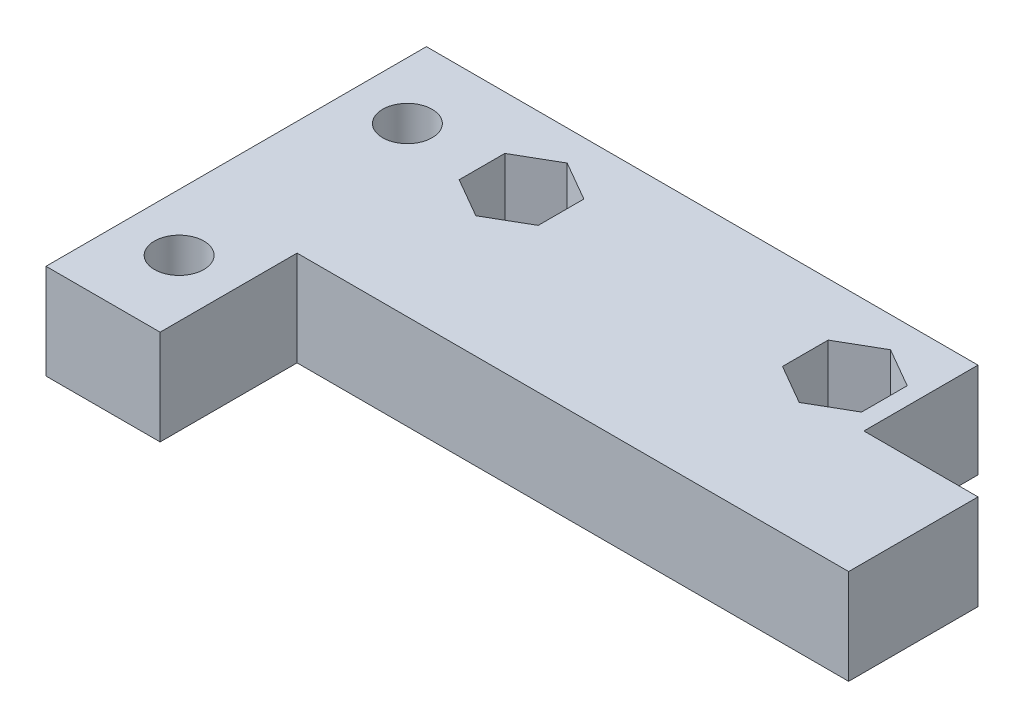
from build123d import *

# Parameters (mm, degrees)
SKETCH_1_W           = 35
SKETCH_1_H           = 20
EXTRUDE_1_DEPTH      = 8
SKETCH_2_W           = 29
SKETCH_2_H           = 14
CUT_EXTRUDE_2_DEPTH  = 0.8
SKETCH_3_W           = 29
SKETCH_3_H           = 7.2
CUT_EXTRUDE_4_DEPTH  = 42.097445176
SKETCH_4_W           = 6
SKETCH_4_H           = 6
CUT_EXTRUDE_5_DEPTH  = 42.097445176
SKETCH_5_R           = 1.3
CUT_EXTRUDE_6_DEPTH  = 42.097445176
CUT_EXTRUDE_START    = 8
CUT_EXTRUDE_8_DEPTH  = 50.097445176
SKETCH_6_R           = 2.2
CUT_EXTRUDE_10_DEPTH = 2
SKETCH_8_W           = 35
SKETCH_8_H           = 20
CUT_EXTRUDE_11_DEPTH = 3


with BuildPart() as part:
    # 草圖1 → 填料-伸長1 (new body)
    with BuildSketch(Plane(origin=(0, 0, 0), x_dir=(1, 0, 0), z_dir=(0, 1, 0))):
        with Locations((17.5, 10)):
            Rectangle(SKETCH_1_W, SKETCH_1_H)
    extrude(amount=EXTRUDE_1_DEPTH)

    # 草圖2 → 除料-伸長2 (cut)
    with BuildSketch(Plane(origin=(0, 0, 0), x_dir=(1, 0, 0), z_dir=(0, 1, 0))):
        with Locations((20.5, 7)):
            Rectangle(SKETCH_2_W, SKETCH_2_H)
    extrude(amount=CUT_EXTRUDE_2_DEPTH, mode=Mode.SUBTRACT)

    # 草圖3 → 除料-伸長4 (cut, through all)
    with BuildSketch(Plane(origin=(0, 0, 0), x_dir=(1, 0, 0), z_dir=(0, 1, 0))):
        with Locations((20.5, 3.6)):
            Rectangle(SKETCH_3_W, SKETCH_3_H)
    extrude(amount=CUT_EXTRUDE_4_DEPTH, mode=Mode.SUBTRACT)

    # 草圖4 → 除料-伸長5 (cut, through all)
    with BuildSketch(Plane(origin=(0, 0, 0), x_dir=(1, 0, 0), z_dir=(0, 1, 0))):
        with Locations((32, 17)):
            Rectangle(SKETCH_4_W, SKETCH_4_H)
    extrude(amount=CUT_EXTRUDE_5_DEPTH, mode=Mode.SUBTRACT)

    # 草圖5 → 除料-伸長6 (cut, through all)
    with BuildSketch(Plane(origin=(0, 0, 0), x_dir=(1, 0, 0), z_dir=(0, 1, 0))):
        with Locations(Location((3, 16, 0), (0, 0, 270))):
            Circle(SKETCH_5_R)
        with Locations(Location((3, 4, 0), (0, 0, 270))):
            Circle(SKETCH_5_R)
        with Locations(Location((9, 16, 0), (0, 0, 270))):
            Circle(SKETCH_5_R)
        with Locations(Location((26, 16, 0), (0, 0, 270))):
            Circle(SKETCH_5_R)
    extrude(amount=CUT_EXTRUDE_6_DEPTH, mode=Mode.SUBTRACT)

    # 草圖7 → 除料-伸長8 (cut, through all)
    with BuildSketch(Plane(origin=(0, 0, 0), x_dir=(1, 0, 0), z_dir=(0, 1, 0)).offset(CUT_EXTRUDE_START)):
        Polygon((26, 18.4), (23.921539031, 17.2), (23.921539031, 14.8), (26, 13.6), (28.078460969, 14.8), (28.078460969, 17.2), align=None)
        Polygon((9, 18.4), (6.921539031, 17.2), (6.921539031, 14.8), (9, 13.6), (11.078460969, 14.8), (11.078460969, 17.2), align=None)
    extrude(amount=-CUT_EXTRUDE_8_DEPTH, mode=Mode.SUBTRACT)

    # 草圖6 → 除料-伸長10 (cut)
    with BuildSketch(Plane(origin=(0, 0, 0), x_dir=(1, 0, 0), z_dir=(0, 1, 0))):
        with Locations(Location((3, 16, 0), (0, 0, 90))):
            Circle(SKETCH_6_R)
        with Locations(Location((3, 4, 0), (0, 0, 90))):
            Circle(SKETCH_6_R)
    extrude(amount=CUT_EXTRUDE_10_DEPTH, mode=Mode.SUBTRACT)

    # 草圖8 → 除料-伸長11 (cut)
    with BuildSketch(Plane(origin=(0, 0, 0), x_dir=(1, 0, 0), z_dir=(0, 1, 0))):
        with Locations((17.5, 10)):
            Rectangle(SKETCH_8_W, SKETCH_8_H)
    extrude(amount=CUT_EXTRUDE_11_DEPTH, mode=Mode.SUBTRACT)


solid = part.part
